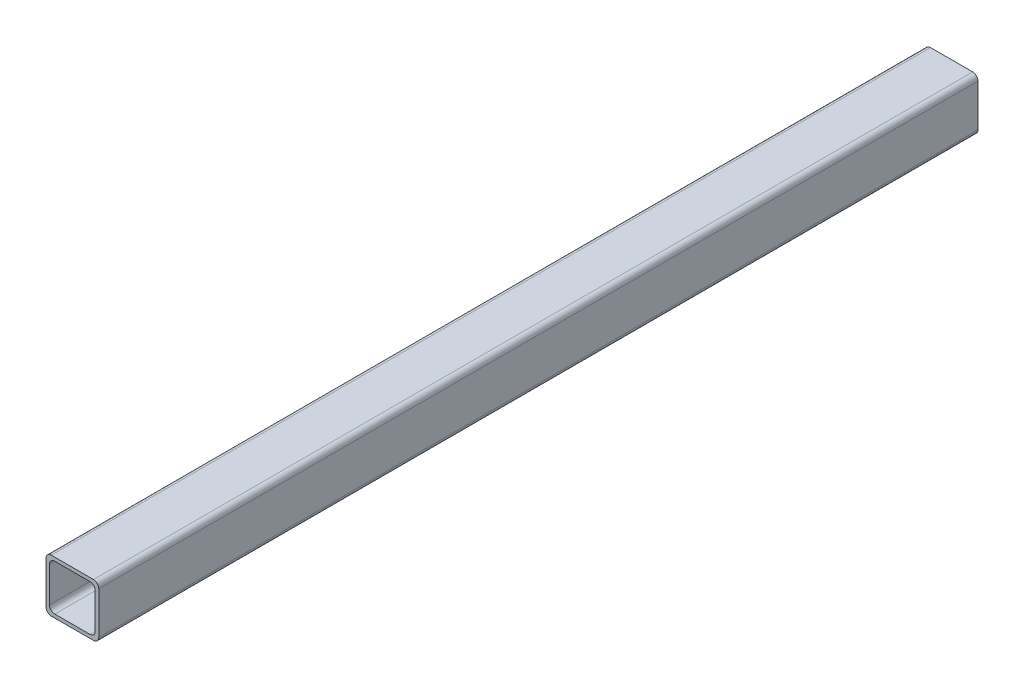
from build123d import *

# Parameters (mm, degrees)
BOSS_EXTRU_1_DEPTH = 500


with BuildPart() as part:
    # Esquisse1 → Boss.-Extru.1 (new body)
    with BuildSketch(Plane.XY):
        with BuildLine():
            Line((-12, -15), (12, -15))
            ThreePointArc((12, -15), (14.121320344, -14.121320344), (15, -12))
            Line((15, -12), (15, 12))
            ThreePointArc((15, 12), (14.121320344, 14.121320344), (12, 15))
            Line((12, 15), (-12, 15))
            ThreePointArc((-12, 15), (-14.121320344, 14.121320344), (-15, 12))
            Line((-15, 12), (-15, -12))
            ThreePointArc((-15, -12), (-14.121320344, -14.121320344), (-12, -15))
        make_face()
        with BuildLine():
            Line((-10, -13), (10, -13))
            ThreePointArc((10, -13), (12.121320344, -12.121320344), (13, -10))
            Line((13, -10), (13, 10))
            ThreePointArc((13, 10), (12.121320344, 12.121320344), (10, 13))
            Line((10, 13), (-10, 13))
            ThreePointArc((-10, 13), (-12.121320344, 12.121320344), (-13, 10))
            Line((-13, 10), (-13, -10))
            ThreePointArc((-13, -10), (-12.121320344, -12.121320344), (-10, -13))
        make_face(mode=Mode.SUBTRACT)
    extrude(amount=-BOSS_EXTRU_1_DEPTH)


solid = part.part
